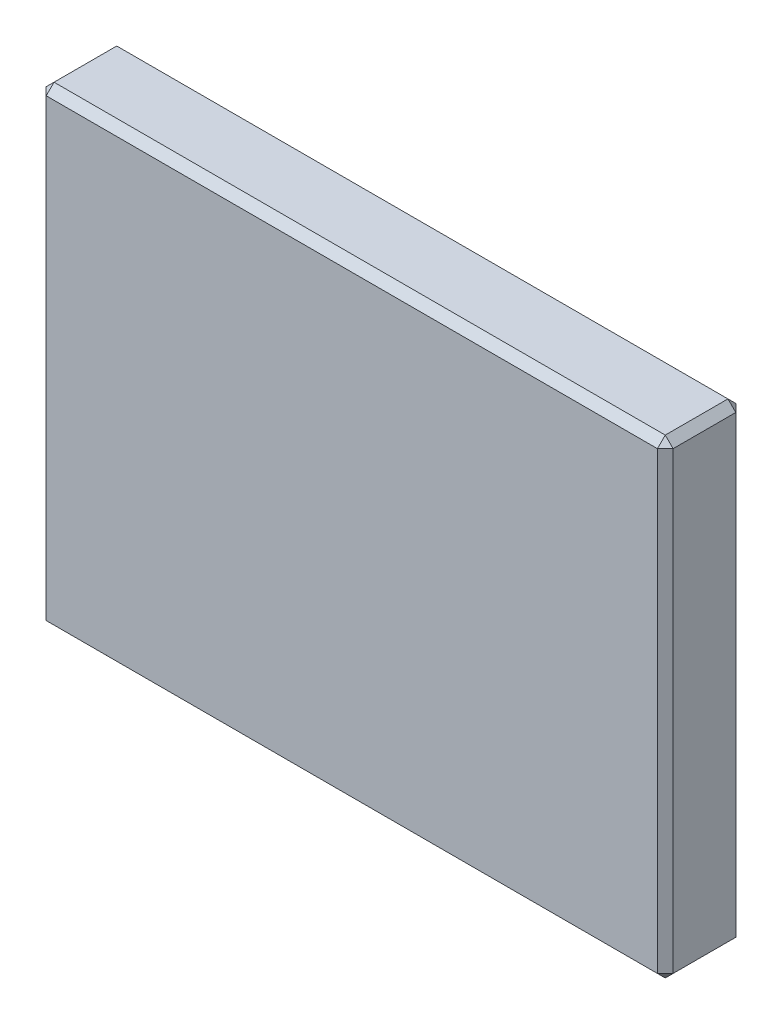
from build123d import *

# Parameters (mm, degrees)
SKETCH1_W           = 101.6
SKETCH1_H           = 76.2
BOSS_EXTRUDE1_DEPTH = 12.7
CHAMFER1_SIZE       = 1.27


with BuildPart() as part:
    # Sketch1 → Boss-Extrude1 (new body)
    with BuildSketch(Plane.XY):
        with Locations((50.8, 38.1)):
            Rectangle(SKETCH1_W, SKETCH1_H)
    extrude(amount=BOSS_EXTRUDE1_DEPTH)

    # Chamfer1
    chamfer1_edges = [part.edges().sort_by_distance(p)[0] for p in [
        (101.6, 38.1, 12.7),
        (50.8, 76.2, 12.7),
        (0, 38.1, 12.7),
        (50.8, 76.2, 0),
        (101.6, 38.1, 0),
        (50.8, 0, 0),
        (0, 38.1, 0),
        (0, 76.2, 6.35),
        (101.6, 76.2, 6.35),
        (101.6, 0, 6.35),
        (0, 0, 6.35),
        (50.8, 0, 12.7),
    ]]
    chamfer(chamfer1_edges, length=CHAMFER1_SIZE)


solid = part.part
